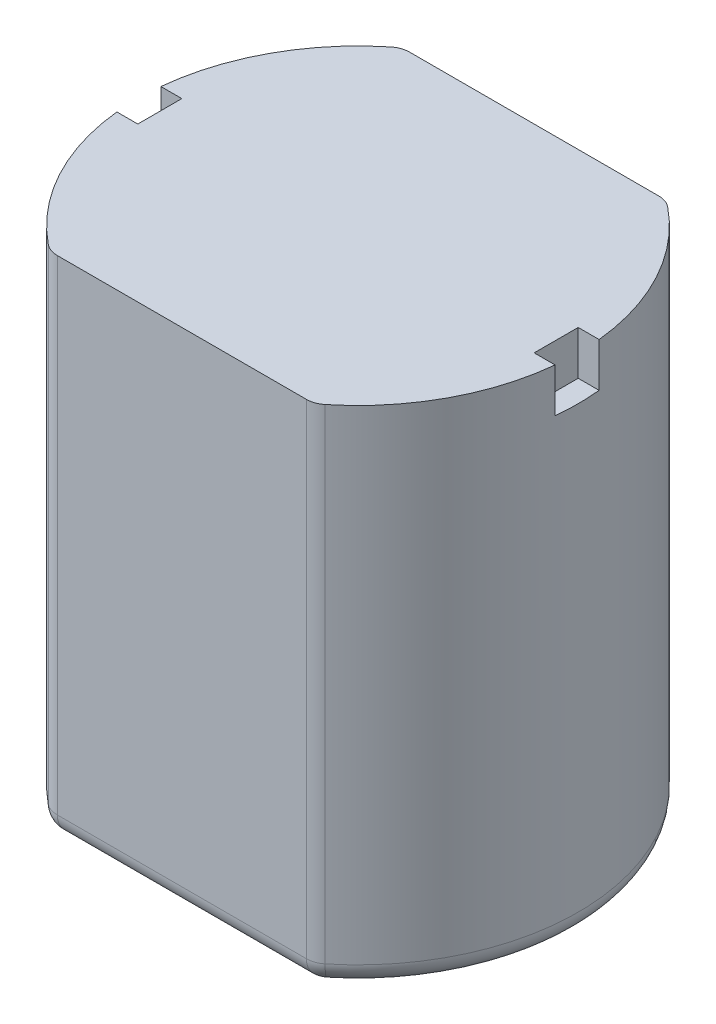
from build123d import *

# Parameters (mm, degrees)
BOSS_EXTRUDE1_DEPTH = 11.5
SKETCH3_W           = 1
SKETCH3_H           = 1
CUT_EXTRUDE1_DEPTH  = 0.5
FILLET1_R           = 0.5
FILLET2_R           = 0.5
SKETCH4_R           = 2
BOSS_EXTRUDE3_DEPTH = 0.25
SKETCH5_R           = 0.25
BOSS_EXTRUDE4_DEPTH = 2.5
SKETCH6_R           = 0.376312749
SKETCH6_R_2         = 0.431953985
CUT_EXTRUDE2_DEPTH  = 0.5


with BuildPart() as part:
    # Sketch1 → Boss-Extrude1 (new body)
    with BuildSketch(Plane(origin=(0, 0, 0), x_dir=(1, 0, 0), z_dir=(0, 1, 0))):
        with BuildLine():
            Line((-3, 4), (3, 4))
            ThreePointArc((3, 4), (5, 0), (3, -4))
            Line((3, -4), (-3, -4))
            ThreePointArc((-3, -4), (-5, 0), (-3, 4))
        make_face()
    extrude(amount=BOSS_EXTRUDE1_DEPTH)

    # Sketch3 → Cut-Extrude1 (cut)
    with BuildSketch(Plane(origin=(5, 0, 0), x_dir=(0, 0, -1), z_dir=(1, 0, 0))):
        with Locations((0, 11)):
            Rectangle(SKETCH3_W, SKETCH3_H)
    cut_extrude1 = extrude(amount=-CUT_EXTRUDE1_DEPTH, mode=Mode.SUBTRACT)

    # Mirror1: Cut-Extrude1 across plane
    add(cut_extrude1.mirror(Plane(origin=(0, 0, 0), x_dir=(0, 0, 1), z_dir=(1, 0, 0))), mode=Mode.SUBTRACT)

    # Fillet1
    fillet1_edges = [part.edges().sort_by_distance(p)[0] for p in [
        (-3, 5.75, -4),
        (-3, 5.75, 4),
        (3, 5.75, 4),
        (3, 5.75, -4),
    ]]
    fillet(fillet1_edges, radius=FILLET1_R)

    # Fillet2
    fillet2_edges = [part.edges().sort_by_distance(p)[0] for p in [
        (-5, 0, 0),
        (0, 0, -4),
        (5, 0, 0),
        (0, 0, 4),
        (2.995093791, 0, 3.971404521),
        (-2.995093791, 0, 3.971404521),
        (2.995093791, 0, -3.971404521),
        (-2.995093791, 0, -3.971404521),
    ]]
    fillet(fillet2_edges, radius=FILLET2_R)

    # Sketch4 → Boss-Extrude3 (add)
    with BuildSketch(Plane.XZ):
        with Locations(Location((0, 0, 0), (0, 0, 90))):
            Circle(SKETCH4_R)
    extrude(amount=BOSS_EXTRUDE3_DEPTH)

    # Sketch5 → Boss-Extrude4 (add)
    with BuildSketch(Plane.XZ.offset(0.25)):
        with Locations(Location((0, 0, 0), (0, 0, 270))):
            Circle(SKETCH5_R)
    extrude(amount=BOSS_EXTRUDE4_DEPTH)

    # Sketch6 → Cut-Extrude2 (cut)
    with BuildSketch(Plane.XZ):
        with Locations(Location((-3, 0, 0), (0, 0, 270))):
            Circle(SKETCH6_R)
        with Locations(Location((3, 0, 0), (0, 0, 270))):
            Circle(SKETCH6_R_2)
    extrude(amount=-CUT_EXTRUDE2_DEPTH, mode=Mode.SUBTRACT)


solid = part.part
